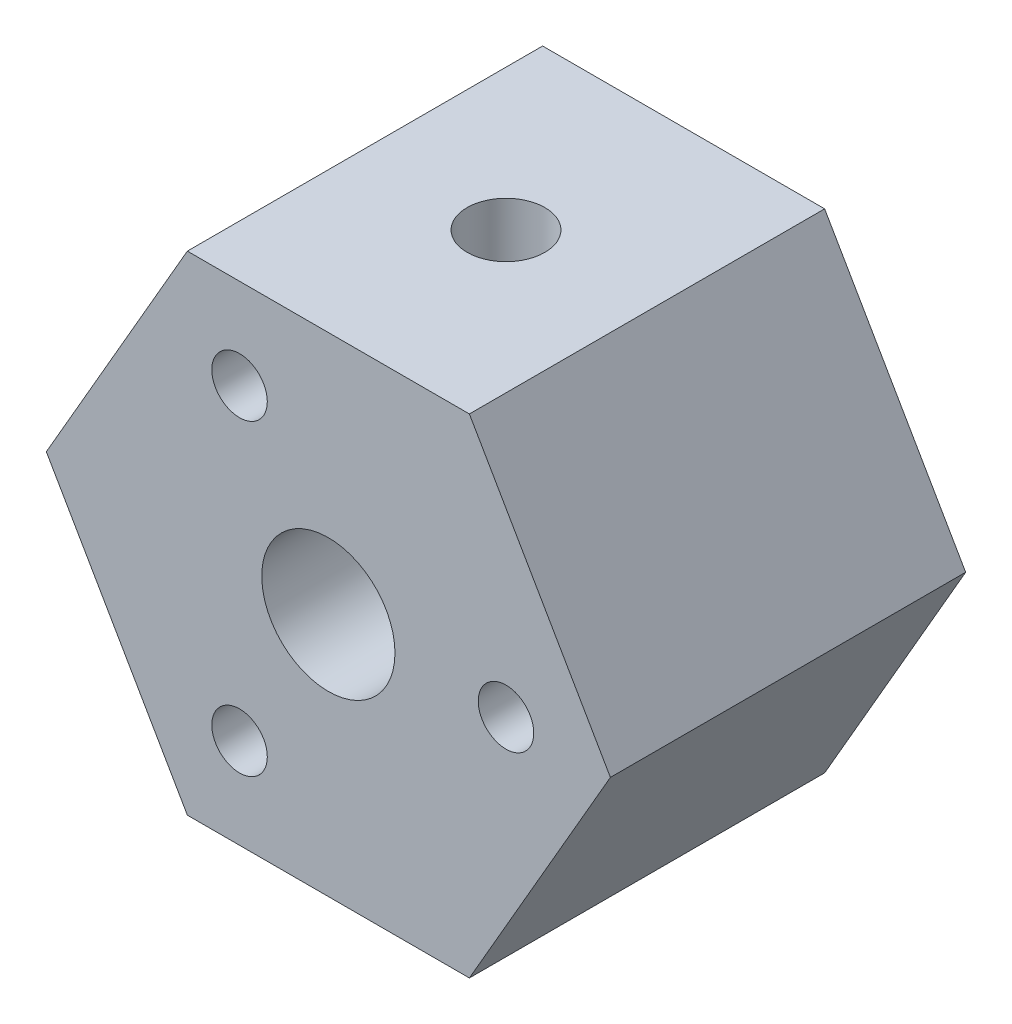
from build123d import *

# Parameters (mm, degrees)
ESQUISSE1_R             = 3
ESQUISSE1_R_2           = 1.25
BOSS_EXTRU_1_DEPTH      = 16
ESQUISSE2_R             = 1.75
ENL_V_MAT_EXTRU_1_DEPTH = 45.093178542


with BuildPart() as part:
    # Esquisse1 → Boss.-Extru.1 (new body)
    with BuildSketch(Plane.XY):
        Polygon((12.701705922, 0), (6.350852961, 11), (-6.350852961, 11), (-12.701705922, 0), (-6.350852961, -11), (6.350852961, -11), align=None)
        Circle(ESQUISSE1_R, mode=Mode.SUBTRACT)
        with Locations((-4, -6.92820323)):
            Circle(ESQUISSE1_R_2, mode=Mode.SUBTRACT)
        with Locations((8, 0)):
            Circle(ESQUISSE1_R_2, mode=Mode.SUBTRACT)
        with Locations((-4, 6.92820323)):
            Circle(ESQUISSE1_R_2, mode=Mode.SUBTRACT)
    extrude(amount=BOSS_EXTRU_1_DEPTH)

    # Esquisse2 → Enlèv. mat.-Extru.1 (cut, through all)
    with BuildSketch(Plane(origin=(22, -11, 0), x_dir=(1, 0, 0), z_dir=(0, 1, 0))):
        with Locations((-22, -8)):
            Circle(ESQUISSE2_R)
    extrude(amount=ENL_V_MAT_EXTRU_1_DEPTH, mode=Mode.SUBTRACT)


solid = part.part
